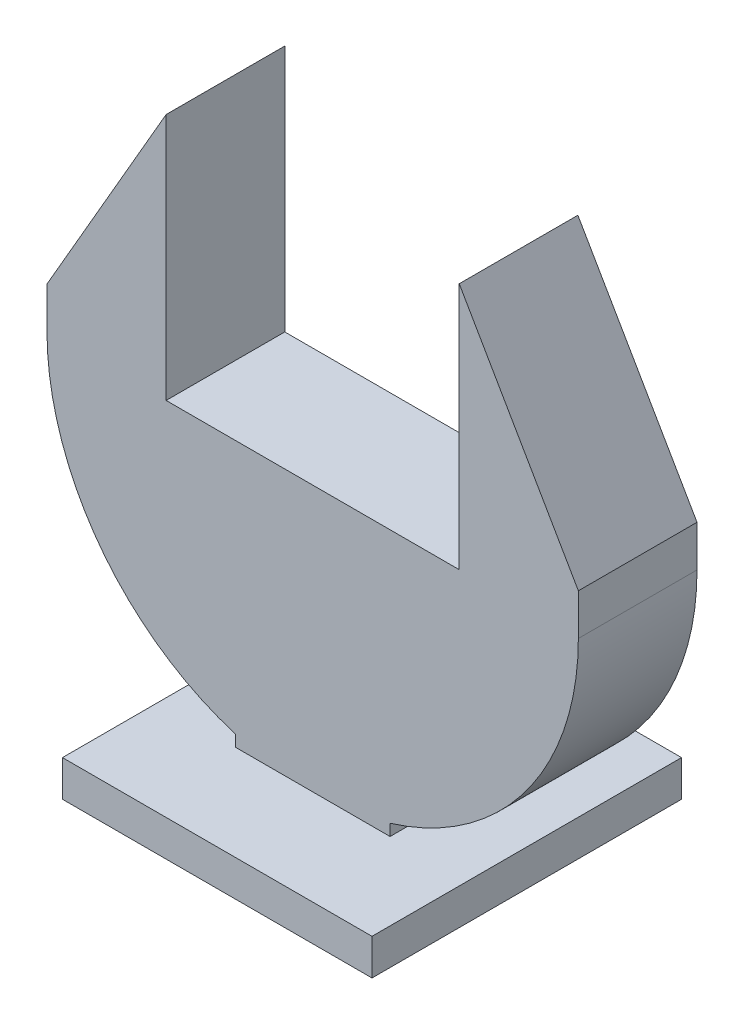
from build123d import *

# Parameters (mm, degrees)
SKETCH_2_W           = 60
SKETCH_2_H           = 60
EXTRUDE_1_DEPTH      = 7
EXTRUDE_2_DEPTH      = 11.5
EXTRUDE_2_DEPTH_BACK = 11.5


with BuildPart() as part:
    # 草图2 → 凸台-拉伸1 (new body)
    with BuildSketch(Plane(origin=(0, 0, 0), x_dir=(1, 0, 0), z_dir=(0, 1, 0))):
        Rectangle(SKETCH_2_W, SKETCH_2_H)
    extrude(amount=EXTRUDE_1_DEPTH)

    # 草图3 → 凸台-拉伸2 (add, two sides: drawn at the far end of the back side and taken through both)
    with BuildSketch(Plane.XY.offset(-EXTRUDE_2_DEPTH_BACK)):
        with BuildLine():
            Line((-28.405989232, 58.5), (28.405989232, 58.5))
            Line((28.405989232, 58.5), (28.405989232, 66.5))
            Line((28.405989232, 66.5), (28.405989232, 106.5))
            Line((28.405989232, 106.5), (51.5, 66.5))
            Line((51.5, 66.5), (51.5, 58.5))
            ThreePointArc((51.5, 58.5), (41.38085306, 27.842619159), (15, 9.232870999))
            Line((15, 9.232870999), (15, 7))
            Line((15, 7), (-15, 7))
            Line((-15, 7), (-15, 9.232870999))
            ThreePointArc((-15, 9.232870999), (-41.38085306, 27.842619159), (-51.5, 58.5))
            Line((-51.5, 58.5), (-51.5, 66.5))
            Line((-51.5, 66.5), (-28.405989232, 106.5))
            Line((-28.405989232, 106.5), (-28.405989232, 66.5))
            Line((-28.405989232, 66.5), (-28.405989232, 58.5))
        make_face()
    extrude(amount=EXTRUDE_2_DEPTH + EXTRUDE_2_DEPTH_BACK)


solid = part.part
